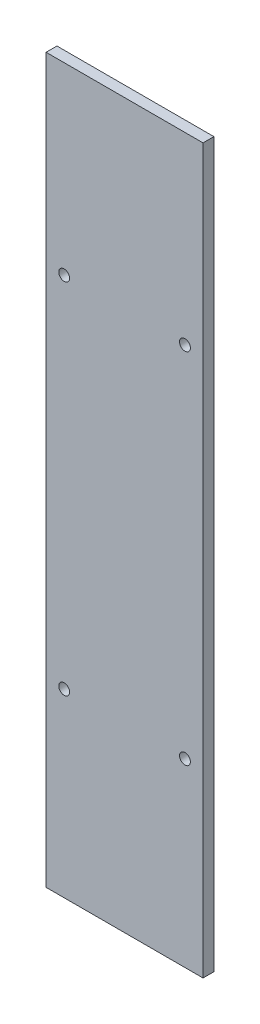
from build123d import *

# Parameters (mm, degrees)
SKETCH_1_W      = 43.4
SKETCH_1_H      = 200
SKETCH_1_R      = 1.5
EXTRUDE_1_DEPTH = 3


with BuildPart() as part:
    # ｽｹｯﾁ1 → ﾎﾞｽ - 押し出し1 (new body)
    with BuildSketch(Plane.XY):
        with Locations((0, 0.442700745)):
            Rectangle(SKETCH_1_W, SKETCH_1_H)
        with Locations((-16.7, 49.557299255)):
            Circle(SKETCH_1_R, mode=Mode.SUBTRACT)
        with Locations((-16.7, -49.557299255)):
            Circle(SKETCH_1_R, mode=Mode.SUBTRACT)
        with Locations((16.7, -49.557299255)):
            Circle(SKETCH_1_R, mode=Mode.SUBTRACT)
        with Locations((16.7, 49.557299255)):
            Circle(SKETCH_1_R, mode=Mode.SUBTRACT)
    extrude(amount=EXTRUDE_1_DEPTH)


solid = part.part
